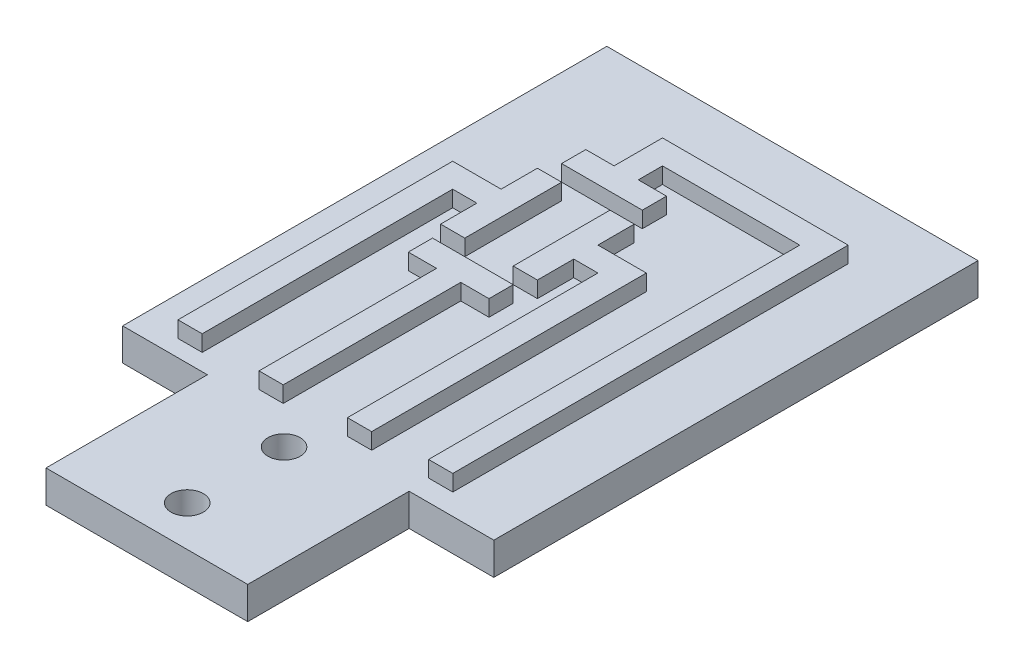
from build123d import *

# Parameters (mm, degrees)
BOSS_EXTRUDE1_DEPTH = 2
SKETCH2_W           = 5
SKETCH2_H           = 1.5
BOSS_EXTRUDE2_DEPTH = 1
SKETCH3_W           = 1.5
SKETCH3_H           = 11
BOSS_EXTRUDE4_DEPTH = 1
SKETCH4_R           = 1
CUT_EXTRUDE1_DEPTH  = 47.184412955
LPATTERN1_COUNT     = 2
LPATTERN1_PITCH     = 6


with BuildPart() as part:
    # Sketch1 → Boss-Extrude1 (new body)
    with BuildSketch(Plane(origin=(0, 0, 0), x_dir=(1, 0, 0), z_dir=(0, 1, 0))):
        Polygon((5.25, -40), (5.25, -30), (0, -30), (0, 0), (23, 0), (23, -30), (17.75, -30), (17.75, -40), align=None)
    extrude(amount=BOSS_EXTRUDE1_DEPTH)

    # Sketch2 → Boss-Extrude2 (add)
    with BuildSketch(Plane(origin=(0, 2, 0), x_dir=(1, 0, 0), z_dir=(0, 1, 0))):
        Polygon((3.88999026, -13.440542412), (5.38999026, -13.440542412), (5.38999026, -15.690542412), (6.88999026, -15.690542412), (6.88999026, -9.690542412), (5.38999026, -9.690542412), (5.38999026, -11.940542412), (3.88999026, -11.940542412), (2.38999026, -11.940542412), (2.38999026, -13.440542412), (2.38999026, -28.962116838), (3.88999026, -28.962116838), align=None)
        with Locations((8.38999026, -7.940542412)):
            Rectangle(SKETCH2_W, SKETCH2_H)
        with Locations((8.38999026, -17.440542412)):
            Rectangle(SKETCH2_W, SKETCH2_H)
        Polygon((11.38999026, -9.690542412), (9.88999026, -9.690542412), (9.88999026, -15.690542412), (11.38999026, -15.690542412), (11.38999026, -13.440542412), (12.88999026, -13.440542412), (12.88999026, -28.962116838), (14.38999026, -28.962116838), (14.38999026, -13.440542412), (14.38999026, -11.940542412), (12.88999026, -11.940542412), (11.38999026, -11.940542412), align=None)
    extrude(amount=BOSS_EXTRUDE2_DEPTH)

    # Sketch3 → Boss-Extrude4 (add)
    with BuildSketch(Plane(origin=(0, 2, 0), x_dir=(1, 0, 0), z_dir=(0, 1, 0))):
        with Locations((8.38999026, -23.690542412)):
            Rectangle(SKETCH3_W, SKETCH3_H)
        Polygon((7.63999026, -4.190542412), (7.63999026, -7.190542412), (9.13999026, -7.190542412), (9.13999026, -5.690542412), (17.646471735, -5.690542412), (17.646471735, -28.690542412), (19.146471735, -28.690542412), (19.146471735, -4.190542412), align=None)
    extrude(amount=BOSS_EXTRUDE4_DEPTH)

    # Sketch4 → Cut-Extrude1 (cut, through all)
    with BuildSketch(Plane(origin=(0, 2, 0), x_dir=(1, 0, 0), z_dir=(0, 1, 0))):
        with Locations(Location((11.5, -37.5, 0), (0, 0, 270))):
            Circle(SKETCH4_R)
    cut_extrude1 = extrude(amount=-CUT_EXTRUDE1_DEPTH, mode=Mode.SUBTRACT)

    # LPattern1: Cut-Extrude1 ×2
    with Locations(*[(0, 0, -i * LPATTERN1_PITCH) for i in range(1, LPATTERN1_COUNT)]):
        add(cut_extrude1, mode=Mode.SUBTRACT)


solid = part.part
